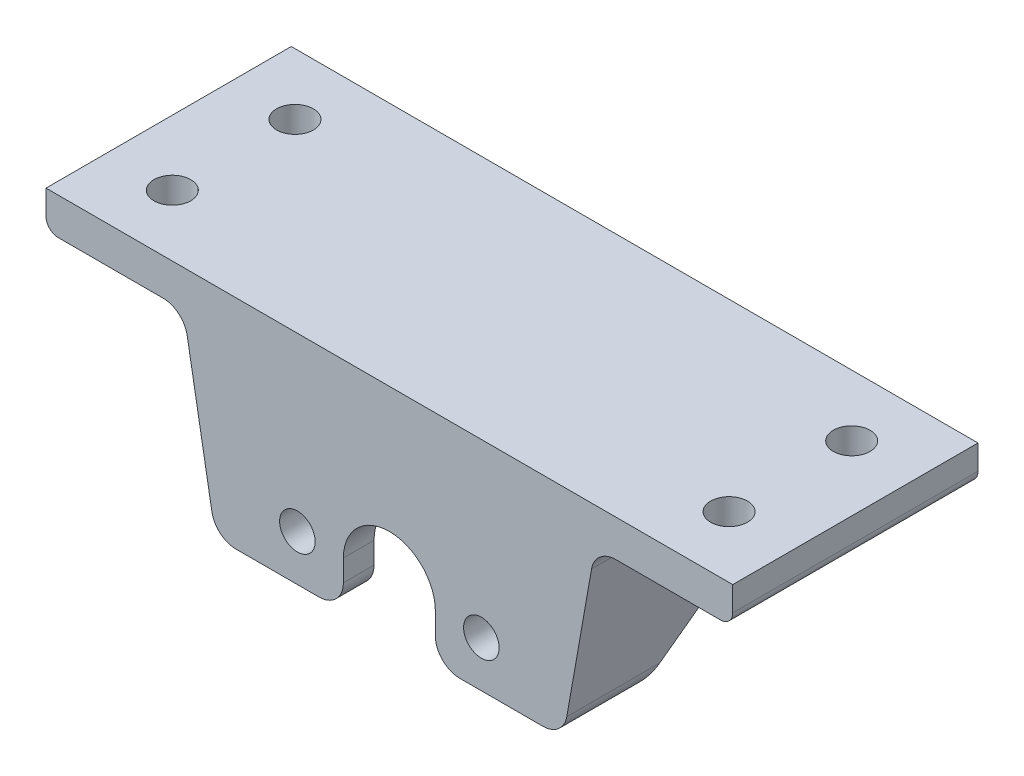
from build123d import *

# Parameters (mm, degrees)
SKETCH2_R               = 1.45
BOSS_EXTRUDE1_DEPTH     = 2.5
BOSS_EXTRUDE2_DEPTH     = 17.5
CUT_EXTRUDE1_DEPTH      = 38.148351242
CUT_EXTRUDE1_DEPTH_BACK = 38.148351242
SKETCH9_R               = 1.5
CUT_EXTRUDE2_DEPTH      = 38.43744783


with BuildPart() as part:
    # Sketch2 → Boss-Extrude1 (new body)
    with BuildSketch(Plane.XY):
        with BuildLine():
            Line((-3.75, 0), (-3.75, -1.75))
            ThreePointArc((-3.75, -1.75), (-4.335786438, -3.164213562), (-5.75, -3.75))
            Line((-5.75, -3.75), (-12.5, -3.75))
            ThreePointArc((-12.5, -3.75), (-13.785575219, -3.282088886), (-14.469615506, -2.097296355))
            Line((-14.469615506, -2.097296355), (-16.487605984, 9.347296355))
            ThreePointArc((-16.487605984, 9.347296355), (-17.171646271, 10.532088886), (-18.45722149, 11))
            Line((-18.45722149, 11), (-27, 11))
            ThreePointArc((-27, 11), (-27.707106781, 11.292893219), (-28, 12))
            Line((-28, 12), (-28, 14))
            Line((-28, 14), (28, 14))
            Line((28, 14), (28, 12))
            ThreePointArc((28, 12), (27.707106781, 11.292893219), (27, 11))
            Line((27, 11), (18.45722149, 11))
            ThreePointArc((18.45722149, 11), (17.171646271, 10.532088886), (16.487605984, 9.347296355))
            Line((16.487605984, 9.347296355), (14.469615506, -2.097296355))
            ThreePointArc((14.469615506, -2.097296355), (13.785575219, -3.282088886), (12.5, -3.75))
            Line((12.5, -3.75), (5.75, -3.75))
            ThreePointArc((5.75, -3.75), (4.335786438, -3.164213562), (3.75, -1.75))
            Line((3.75, -1.75), (3.75, 0))
            ThreePointArc((3.75, 0), (0, 3.75), (-3.75, 0))
        make_face()
        with Locations((-7.5, 0)):
            Circle(SKETCH2_R, mode=Mode.SUBTRACT)
        with Locations((7.5, 0)):
            Circle(SKETCH2_R, mode=Mode.SUBTRACT)
    extrude(amount=-BOSS_EXTRUDE1_DEPTH)

    # Sketch3 → Boss-Extrude2 (add)
    with BuildSketch(Plane(origin=(0, 0, -2.5), x_dir=(-1, 0, 0), z_dir=(0, 0, -1))):
        with BuildLine():
            Line((-11, -2.75), (-11, 6))
            ThreePointArc((-11, 6), (-9.535533906, 9.535533906), (-6, 11))
            Line((-6, 11), (6, 11))
            ThreePointArc((6, 11), (9.535533906, 9.535533906), (11, 6))
            Line((11, 6), (11, -2.75))
            ThreePointArc((11, -2.75), (11.292893219, -3.457106781), (12, -3.75))
            Line((12, -3.75), (12.5, -3.75))
            ThreePointArc((12.5, -3.75), (13.785575219, -3.282088886), (14.469615506, -2.097296355))
            Line((14.469615506, -2.097296355), (16.487605984, 9.347296355))
            ThreePointArc((16.487605984, 9.347296355), (17.171646271, 10.532088886), (18.45722149, 11))
            Line((18.45722149, 11), (27, 11))
            ThreePointArc((27, 11), (27.707106781, 11.292893219), (28, 12))
            Line((28, 12), (28, 14))
            Line((28, 14), (-28, 14))
            Line((-28, 14), (-28, 12))
            ThreePointArc((-28, 12), (-27.707106781, 11.292893219), (-27, 11))
            Line((-27, 11), (-18.45722149, 11))
            ThreePointArc((-18.45722149, 11), (-17.171646271, 10.532088886), (-16.487605984, 9.347296355))
            Line((-16.487605984, 9.347296355), (-14.469615506, -2.097296355))
            ThreePointArc((-14.469615506, -2.097296355), (-13.785575219, -3.282088886), (-12.5, -3.75))
            Line((-12.5, -3.75), (-12, -3.75))
            ThreePointArc((-12, -3.75), (-11.292893219, -3.457106781), (-11, -2.75))
        make_face()
    extrude(amount=BOSS_EXTRUDE2_DEPTH)

    # Sketch6 → Cut-Extrude1 (cut, two sides: drawn at the far end of the back side and taken through both)
    with BuildSketch(Plane(origin=(0, 0, 0), x_dir=(0, 0, -1), z_dir=(1, 0, 0)).offset(-CUT_EXTRUDE1_DEPTH_BACK)):
        Polygon((6, -3.75), (20, 11), (20, -3.75), align=None)
    extrude(amount=CUT_EXTRUDE1_DEPTH + CUT_EXTRUDE1_DEPTH_BACK, mode=Mode.SUBTRACT)

    # Sketch9 → Cut-Extrude2 (cut, through all)
    with BuildSketch(Plane.XZ.offset(-11)):
        with Locations((22.7, -15)):
            Circle(SKETCH9_R)
        with Locations((22.7, -5)):
            Circle(SKETCH9_R)
    cut_extrude2 = extrude(amount=-CUT_EXTRUDE2_DEPTH, mode=Mode.SUBTRACT)

    # Mirror1: Cut-Extrude2 across plane
    add(cut_extrude2.mirror(Plane(origin=(0, 0, 0), x_dir=(0, 0, 1), z_dir=(1, 0, 0))), mode=Mode.SUBTRACT)


solid = part.part
